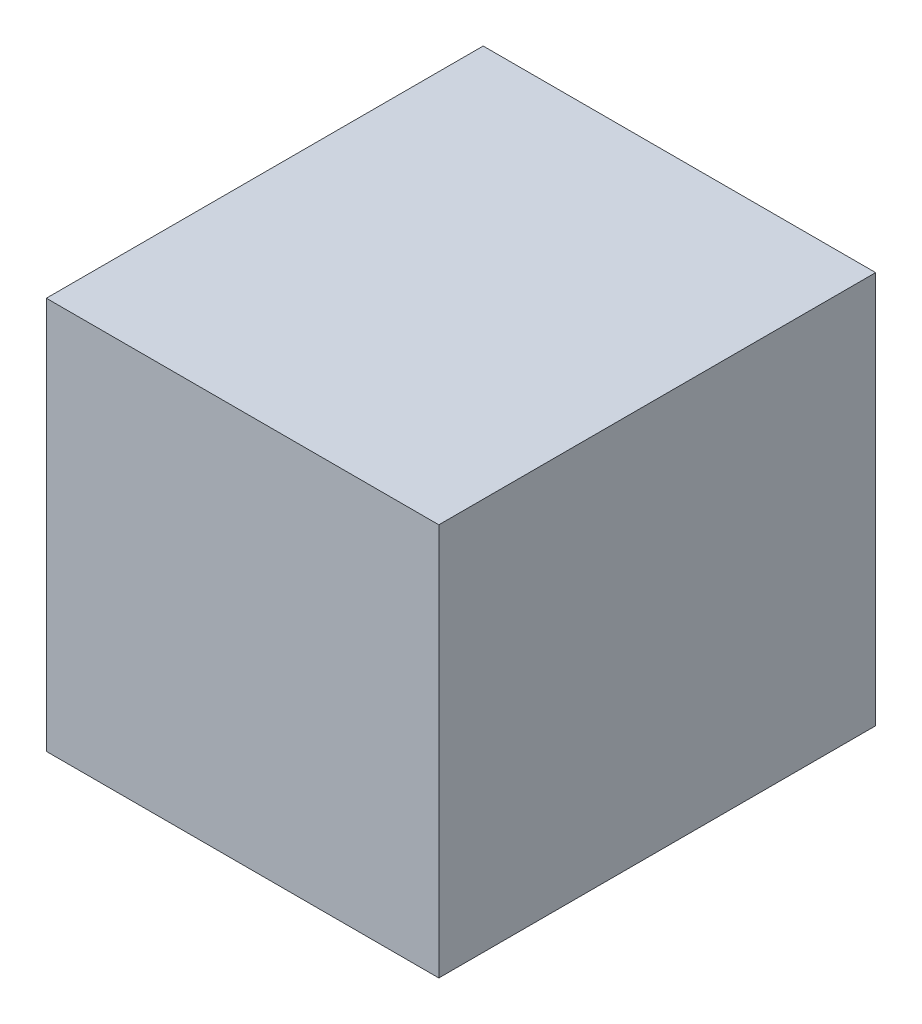
from build123d import *

# Parameters (mm, degrees)
SKETCH1_W           = 89.916
SKETCH1_H           = 89.916
BOSS_EXTRUDE1_DEPTH = 100.076


with BuildPart() as part:
    # Sketch1 → Boss-Extrude1 (new body)
    with BuildSketch(Plane.XY):
        Rectangle(SKETCH1_W, SKETCH1_H)
    extrude(amount=BOSS_EXTRUDE1_DEPTH)


solid = part.part
